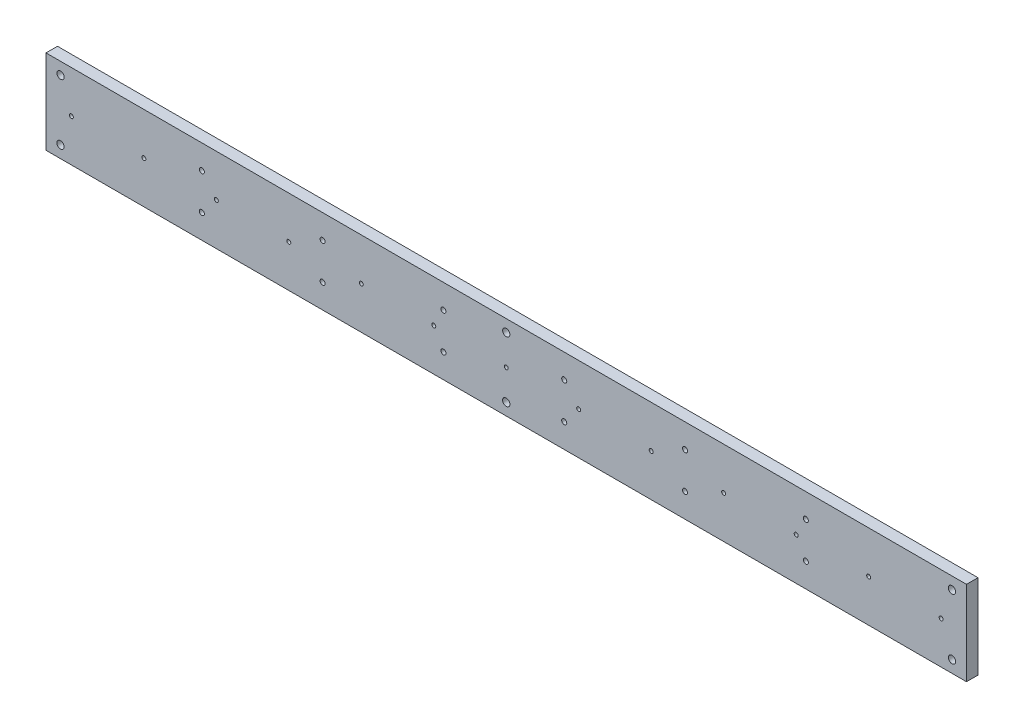
from build123d import *

# Parameters (mm, degrees)
SKETCH1_W                 = 762
SKETCH1_H                 = 69.85
BOSS_EXTRUDE1_DEPTH       = 9.525
HOLE1_D                   = 6
HOLE1_CBORE_D             = 12
HOLE1_CBORE_DEPTH         = 4.1
M4X0_7_TAPPED_HOLE1_D     = 3.3
M4X0_7_TAPPED_HOLE1_DEPTH = 10.1
M4X0_7_TAPPED_HOLE1_TIP   = 0.991420021
M5X0_8_TAPPED_HOLE1_D     = 4.2
M5X0_8_TAPPED_HOLE1_DEPTH = 12.4
M5X0_8_TAPPED_HOLE1_TIP   = 1.2618073


with BuildPart() as part:
    # Sketch1 → Boss-Extrude1 (new body)
    with BuildSketch(Plane.XY):
        with Locations((381, 34.925)):
            Rectangle(SKETCH1_W, SKETCH1_H)
    extrude(amount=BOSS_EXTRUDE1_DEPTH)

    # Hole1 (through all)
    with Locations(Plane(origin=(750, 59.925, 0), x_dir=(-1, 0, 0), z_dir=(0, 0, -1))):
        with Locations((0, 0), (0, -50), (369, 0), (369, -50), (738, 0), (738, -50)):
            CounterBoreHole(HOLE1_D / 2, HOLE1_CBORE_D / 2, HOLE1_CBORE_DEPTH)

    # M4x0.7 Tapped Hole1
    with Locations(Plane(origin=(741, 34.925, 0), x_dir=(-1, 0, 0), z_dir=(0, 0, -1))):
        with Locations((0, 0), (60, 0), (120, 0), (180, 0), (240, 0), (300, 0), (360, 0), (420, 0), (480, 0), (540, 0), (600, 0), (660, 0), (720, 0)):
            Hole(M4X0_7_TAPPED_HOLE1_D / 2, depth=M4X0_7_TAPPED_HOLE1_DEPTH)
            with Locations((0, 0, -(M4X0_7_TAPPED_HOLE1_DEPTH + M4X0_7_TAPPED_HOLE1_TIP / 2))):  # 118° drill point
                Cone(0, M4X0_7_TAPPED_HOLE1_D / 2, M4X0_7_TAPPED_HOLE1_TIP, mode=Mode.SUBTRACT)

    # M5x0.8 Tapped Hole1
    with Locations(Plane(origin=(629, 49.925, 0), x_dir=(-1, 0, 0), z_dir=(0, 0, -1))):
        with Locations((0, 0), (0, -30), (100, 0), (100, -30), (200, 0), (200, -30), (300, 0), (300, -30), (400, 0), (400, -30), (500, 0), (500, -30)):
            Hole(M5X0_8_TAPPED_HOLE1_D / 2, depth=M5X0_8_TAPPED_HOLE1_DEPTH)
            with Locations((0, 0, -(M5X0_8_TAPPED_HOLE1_DEPTH + M5X0_8_TAPPED_HOLE1_TIP / 2))):  # 118° drill point
                Cone(0, M5X0_8_TAPPED_HOLE1_D / 2, M5X0_8_TAPPED_HOLE1_TIP, mode=Mode.SUBTRACT)


solid = part.part
